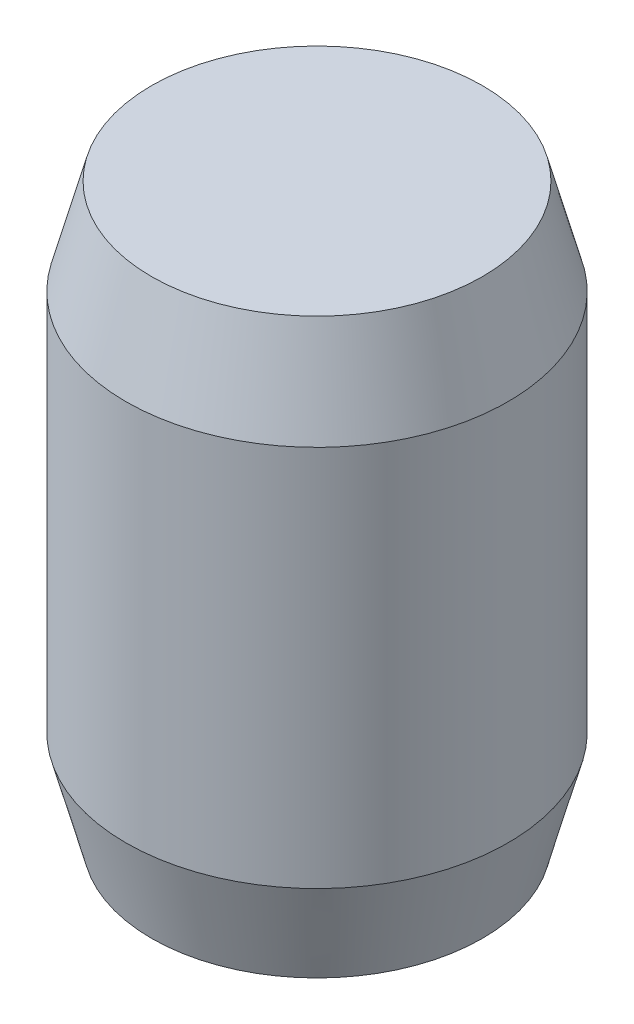
from build123d import *


with BuildPart() as part:
    # 草图2 → 旋转1 (revolve)
    with BuildSketch(Plane.XY):
        Polygon((1.732050808, 6), (2, 5), (2, 1), (1.732050808, 0), (0, 0), (0, 6), align=None)
    revolve(axis=Axis((0, 0, 0), (0, 1, 0)))


solid = part.part
